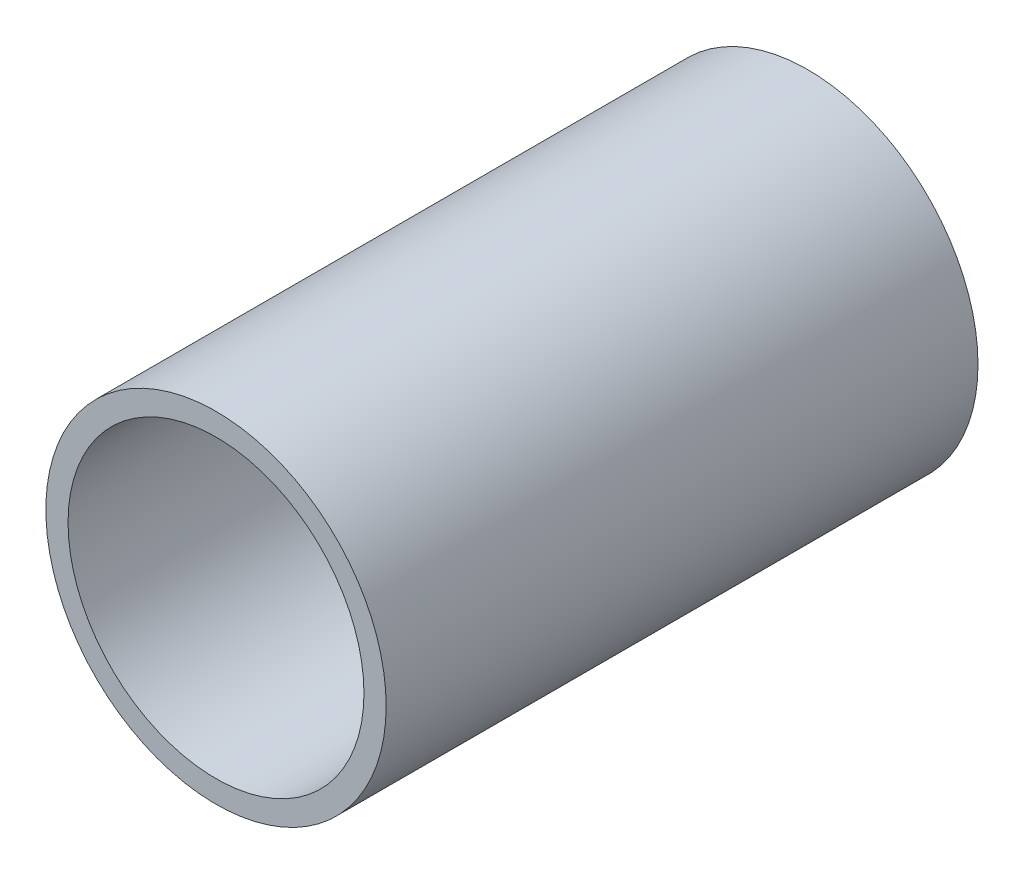
from build123d import *

# Parameters (mm, degrees)
SKETCH1_R           = 17.25
SKETCH1_R_2         = 15
BOSS_EXTRUDE1_DEPTH = 60


with BuildPart() as part:
    # Sketch1 → Boss-Extrude1 (new body)
    with BuildSketch(Plane.XY):
        Circle(SKETCH1_R)
        Circle(SKETCH1_R_2, mode=Mode.SUBTRACT)
    extrude(amount=BOSS_EXTRUDE1_DEPTH)


solid = part.part
